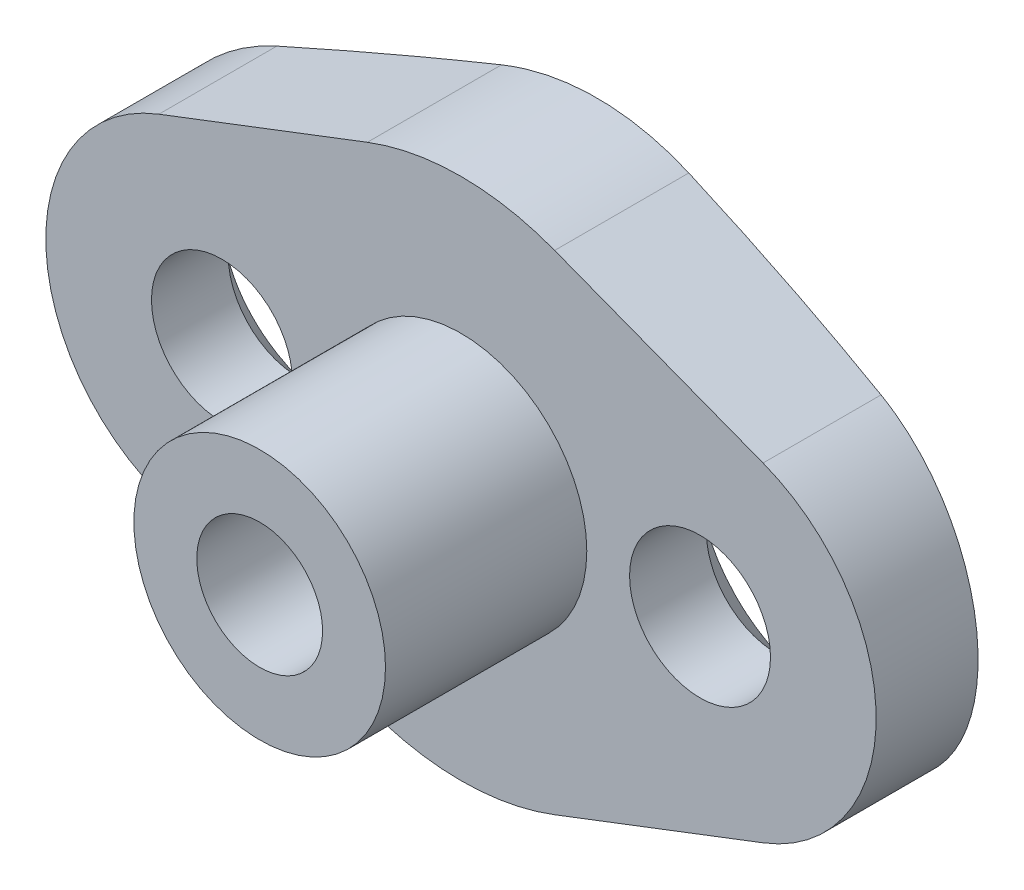
from build123d import *

# Parameters (mm, degrees)
SKETCH3_R          = 1.778
EXTRUDE1_DEPTH     = 3.429
SKETCH4_R          = 3.175
SKETCH4_R_2        = 1.5875
EXTRUDE2_DEPTH     = 5.08
CUT_EXTRUDE2_DEPTH = 38.1


with BuildPart() as part:
    # Sketch3 → Extrude1 (new body)
    with BuildSketch(Plane.XY):
        with BuildLine():
            Line((2.363536842, 6.16656384), (7.623342105, 4.150571816))
            ThreePointArc((7.623342105, 4.150571816), (10.4775, 0), (7.623342105, -4.150571816))
            Line((7.623342105, -4.150571816), (2.363536842, -6.16656384))
            ThreePointArc((2.363536842, -6.16656384), (0, -6.604), (-2.363536842, -6.16656384))
            Line((-2.363536842, -6.16656384), (-7.623342105, -4.150571816))
            ThreePointArc((-7.623342105, -4.150571816), (-10.4775, 0), (-7.623342105, 4.150571816))
            Line((-7.623342105, 4.150571816), (-2.363536842, 6.16656384))
            ThreePointArc((-2.363536842, 6.16656384), (0, 6.604), (2.363536842, 6.16656384))
        make_face()
        with Locations((-6.0325, 0)):
            Circle(SKETCH3_R, mode=Mode.SUBTRACT)
        with Locations((6.0325, 0)):
            Circle(SKETCH3_R, mode=Mode.SUBTRACT)
    extrude(amount=EXTRUDE1_DEPTH)

    # Sketch4 → Extrude2 (add)
    with BuildSketch(Plane.XY.offset(3.429)):
        Circle(SKETCH4_R)
        Circle(SKETCH4_R_2, mode=Mode.SUBTRACT)
    extrude(amount=EXTRUDE2_DEPTH)

    # Cut-Extrude1 cone 1 section (through the dimple's axis) → Cut-Extrude1 (revolve, cut)
    with BuildSketch(Plane.YZ.offset(6.0325)):
        Polygon((0, 0), (3.556, 0), (0, 2.983838288), align=None)
    revolve(axis=Axis((6.0325, 0, 0), (0, 0, 1)), mode=Mode.SUBTRACT)

    # Cut-Extrude1 cone 2 section (through the dimple's axis) → Cut-Extrude1 cone 2 (revolve, cut)
    with BuildSketch(Plane.YZ.offset(-6.0325)):
        Polygon((0, 0), (3.556, 0), (0, 2.983838288), align=None)
    revolve(axis=Axis((-6.0325, 0, 0), (0, 0, 1)), mode=Mode.SUBTRACT)

    # Sketch6 → Cut-Extrude2 (cut, symmetric)
    with BuildSketch(Plane(origin=(0, 0, 0), x_dir=(1, 0, 0), z_dir=(0, 1, 0))):
        with BuildLine():
            Line((10.4775, -0.85725), (10.4775, 0.508))
            Line((10.4775, 0.508), (-10.4775, 0.508))
            Line((-10.4775, 0.508), (-10.4775, -0.85725))
            ThreePointArc((-10.4775, -0.85725), (0, 0), (10.4775, -0.85725))
        make_face()
    extrude(amount=CUT_EXTRUDE2_DEPTH, both=True, mode=Mode.SUBTRACT)


solid = part.part
